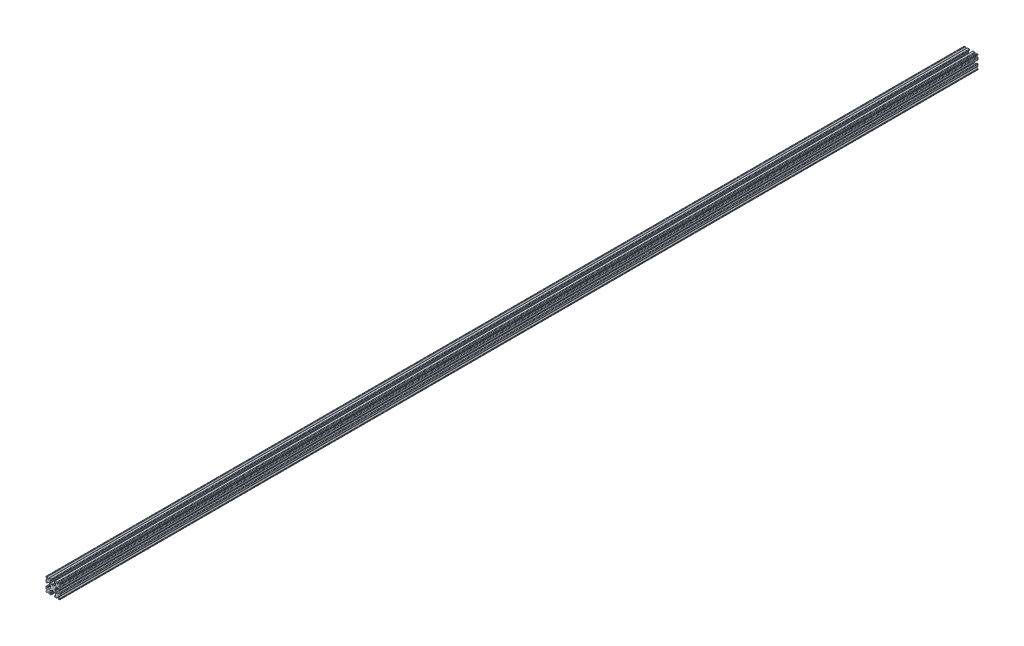
from build123d import *

# Parameters (mm, degrees)
BOSS_EXTRUDE1_DEPTH = 1000


with BuildPart() as part:
    # Sketch1 → Boss-Extrude1 (new body)
    with BuildSketch(Plane.XY):
        with BuildLine():
            Line((0.8255, -2.5470646), (0.8255, -2.774891226))
            ThreePointArc((0.8255, -2.774891226), (0.869377519, -2.89989431), (0.981757709, -2.970049142))
            Line((0.981757709, -2.970049142), (2.509355728, -3.312441801))
            ThreePointArc((2.509355728, -3.312441801), (2.790306203, -3.487828881), (2.9, -3.80033659))
            Line((2.9, -3.80033659), (2.9, -5.9))
            ThreePointArc((2.9, -5.9), (2.841421356, -6.041421356), (2.7, -6.1))
            Line((2.7, -6.1), (2.1, -6.1))
            ThreePointArc((2.1, -6.1), (1.746446609, -6.246446609), (1.6, -6.6))
            Line((1.6, -6.6), (1.6, -7))
            ThreePointArc((1.6, -7), (1.746446609, -7.353553391), (2.1, -7.5))
            Line((2.1, -7.5), (3.9, -7.5))
            ThreePointArc((3.9, -7.5), (4.253553391, -7.353553391), (4.4, -7))
            Line((4.4, -7), (4.4, -6.667766953))
            ThreePointArc((4.4, -6.667766953), (4.708658284, -6.205827187), (5.253553391, -6.314213562))
            Line((5.253553391, -6.314213562), (6.292893219, -7.353553391))
            ThreePointArc((6.292893219, -7.353553391), (6.455104893, -7.461939766), (6.646446609, -7.5))
            Line((6.646446609, -7.5), (7.25, -7.5))
            ThreePointArc((7.25, -7.5), (7.426776695, -7.426776695), (7.5, -7.25))
            Line((7.5, -7.25), (7.5, -6.646446609))
            ThreePointArc((7.5, -6.646446609), (7.461939766, -6.455104893), (7.353553391, -6.292893219))
            Line((7.353553391, -6.292893219), (6.314213562, -5.253553391))
            ThreePointArc((6.314213562, -5.253553391), (6.205827187, -4.708658284), (6.667766953, -4.4))
            Line((6.667766953, -4.4), (7, -4.4))
            ThreePointArc((7, -4.4), (7.353553391, -4.253553391), (7.5, -3.9))
            Line((7.5, -3.9), (7.5, -2.1))
            ThreePointArc((7.5, -2.1), (7.353553391, -1.746446609), (7, -1.6))
            Line((7, -1.6), (6.6, -1.6))
            ThreePointArc((6.6, -1.6), (6.246446609, -1.746446609), (6.1, -2.1))
            Line((6.1, -2.1), (6.1, -2.7))
            ThreePointArc((6.1, -2.7), (6.041421356, -2.841421356), (5.9, -2.9))
            Line((5.9, -2.9), (3.80033659, -2.9))
            ThreePointArc((3.80033659, -2.9), (3.487828881, -2.790306203), (3.312441801, -2.509355728))
            Line((3.312441801, -2.509355728), (2.970049142, -0.981757709))
            ThreePointArc((2.970049142, -0.981757709), (2.89989431, -0.869377519), (2.774891226, -0.8255))
            Line((2.774891226, -0.8255), (2.5470646, -0.8255))
            ThreePointArc((2.5470646, -0.8255), (2.405643244, -0.766921356), (2.3470646, -0.6255))
            Line((2.3470646, -0.6255), (2.3470646, 0.6255))
            ThreePointArc((2.3470646, 0.6255), (2.405643244, 0.766921356), (2.5470646, 0.8255))
            Line((2.5470646, 0.8255), (2.774891226, 0.8255))
            ThreePointArc((2.774891226, 0.8255), (2.89989431, 0.869377519), (2.970049142, 0.981757709))
            Line((2.970049142, 0.981757709), (3.312441801, 2.509355728))
            ThreePointArc((3.312441801, 2.509355728), (3.487828881, 2.790306203), (3.80033659, 2.9))
            Line((3.80033659, 2.9), (5.9, 2.9))
            ThreePointArc((5.9, 2.9), (6.041421356, 2.841421356), (6.1, 2.7))
            Line((6.1, 2.7), (6.1, 2.1))
            ThreePointArc((6.1, 2.1), (6.246446609, 1.746446609), (6.6, 1.6))
            Line((6.6, 1.6), (7, 1.6))
            ThreePointArc((7, 1.6), (7.353553391, 1.746446609), (7.5, 2.1))
            Line((7.5, 2.1), (7.5, 3.9))
            ThreePointArc((7.5, 3.9), (7.353553391, 4.253553391), (7, 4.4))
            Line((7, 4.4), (6.667766953, 4.4))
            ThreePointArc((6.667766953, 4.4), (6.205827187, 4.708658284), (6.314213562, 5.253553391))
            Line((6.314213562, 5.253553391), (7.353553391, 6.292893219))
            ThreePointArc((7.353553391, 6.292893219), (7.461939766, 6.455104893), (7.5, 6.646446609))
            Line((7.5, 6.646446609), (7.5, 7.25))
            ThreePointArc((7.5, 7.25), (7.426776695, 7.426776695), (7.25, 7.5))
            Line((7.25, 7.5), (6.646446609, 7.5))
            ThreePointArc((6.646446609, 7.5), (6.455104893, 7.461939766), (6.292893219, 7.353553391))
            Line((6.292893219, 7.353553391), (5.253553391, 6.314213562))
            ThreePointArc((5.253553391, 6.314213562), (4.708658284, 6.205827187), (4.4, 6.667766953))
            Line((4.4, 6.667766953), (4.4, 7))
            ThreePointArc((4.4, 7), (4.253553391, 7.353553391), (3.9, 7.5))
            Line((3.9, 7.5), (2.1, 7.5))
            ThreePointArc((2.1, 7.5), (1.746446609, 7.353553391), (1.6, 7))
            Line((1.6, 7), (1.6, 6.6))
            ThreePointArc((1.6, 6.6), (1.746446609, 6.246446609), (2.1, 6.1))
            Line((2.1, 6.1), (2.7, 6.1))
            ThreePointArc((2.7, 6.1), (2.841421356, 6.041421356), (2.9, 5.9))
            Line((2.9, 5.9), (2.9, 3.80033659))
            ThreePointArc((2.9, 3.80033659), (2.790306203, 3.487828881), (2.509355728, 3.312441801))
            Line((2.509355728, 3.312441801), (0.981757709, 2.970049142))
            ThreePointArc((0.981757709, 2.970049142), (0.869377519, 2.89989431), (0.8255, 2.774891226))
            Line((0.8255, 2.774891226), (0.8255, 2.5470646))
            ThreePointArc((0.8255, 2.5470646), (0.766921356, 2.405643244), (0.6255, 2.3470646))
            Line((0.6255, 2.3470646), (-0.6255, 2.3470646))
            ThreePointArc((-0.6255, 2.3470646), (-0.766921356, 2.405643244), (-0.8255, 2.5470646))
            Line((-0.8255, 2.5470646), (-0.8255, 2.774891226))
            ThreePointArc((-0.8255, 2.774891226), (-0.869377519, 2.89989431), (-0.981757709, 2.970049142))
            Line((-0.981757709, 2.970049142), (-2.509355728, 3.312441801))
            ThreePointArc((-2.509355728, 3.312441801), (-2.790306203, 3.487828881), (-2.9, 3.80033659))
            Line((-2.9, 3.80033659), (-2.9, 5.9))
            ThreePointArc((-2.9, 5.9), (-2.841421356, 6.041421356), (-2.7, 6.1))
            Line((-2.7, 6.1), (-2.1, 6.1))
            ThreePointArc((-2.1, 6.1), (-1.746446609, 6.246446609), (-1.6, 6.6))
            Line((-1.6, 6.6), (-1.6, 7))
            ThreePointArc((-1.6, 7), (-1.746446609, 7.353553391), (-2.1, 7.5))
            Line((-2.1, 7.5), (-3.9, 7.5))
            ThreePointArc((-3.9, 7.5), (-4.253553391, 7.353553391), (-4.4, 7))
            Line((-4.4, 7), (-4.4, 6.667766953))
            ThreePointArc((-4.4, 6.667766953), (-4.708658284, 6.205827187), (-5.253553391, 6.314213562))
            Line((-5.253553391, 6.314213562), (-6.292893219, 7.353553391))
            ThreePointArc((-6.292893219, 7.353553391), (-6.455104893, 7.461939766), (-6.646446609, 7.5))
            Line((-6.646446609, 7.5), (-7.25, 7.5))
            ThreePointArc((-7.25, 7.5), (-7.426776695, 7.426776695), (-7.5, 7.25))
            Line((-7.5, 7.25), (-7.5, 6.646446609))
            ThreePointArc((-7.5, 6.646446609), (-7.461939766, 6.455104893), (-7.353553391, 6.292893219))
            Line((-7.353553391, 6.292893219), (-6.314213562, 5.253553391))
            ThreePointArc((-6.314213562, 5.253553391), (-6.205827187, 4.708658284), (-6.667766953, 4.4))
            Line((-6.667766953, 4.4), (-7, 4.4))
            ThreePointArc((-7, 4.4), (-7.353553391, 4.253553391), (-7.5, 3.9))
            Line((-7.5, 3.9), (-7.5, 2.1))
            ThreePointArc((-7.5, 2.1), (-7.353553391, 1.746446609), (-7, 1.6))
            Line((-7, 1.6), (-6.6, 1.6))
            ThreePointArc((-6.6, 1.6), (-6.246446609, 1.746446609), (-6.1, 2.1))
            Line((-6.1, 2.1), (-6.1, 2.7))
            ThreePointArc((-6.1, 2.7), (-6.041421356, 2.841421356), (-5.9, 2.9))
            Line((-5.9, 2.9), (-3.80033659, 2.9))
            ThreePointArc((-3.80033659, 2.9), (-3.487828881, 2.790306203), (-3.312441801, 2.509355728))
            Line((-3.312441801, 2.509355728), (-2.970049142, 0.981757709))
            ThreePointArc((-2.970049142, 0.981757709), (-2.89989431, 0.869377519), (-2.774891226, 0.8255))
            Line((-2.774891226, 0.8255), (-2.5470646, 0.8255))
            ThreePointArc((-2.5470646, 0.8255), (-2.405643244, 0.766921356), (-2.3470646, 0.6255))
            Line((-2.3470646, 0.6255), (-2.3470646, -0.6255))
            ThreePointArc((-2.3470646, -0.6255), (-2.405643244, -0.766921356), (-2.5470646, -0.8255))
            Line((-2.5470646, -0.8255), (-2.774891226, -0.8255))
            ThreePointArc((-2.774891226, -0.8255), (-2.89989431, -0.869377519), (-2.970049142, -0.981757709))
            Line((-2.970049142, -0.981757709), (-3.312441801, -2.509355728))
            ThreePointArc((-3.312441801, -2.509355728), (-3.487828881, -2.790306203), (-3.80033659, -2.9))
            Line((-3.80033659, -2.9), (-5.9, -2.9))
            ThreePointArc((-5.9, -2.9), (-6.041421356, -2.841421356), (-6.1, -2.7))
            Line((-6.1, -2.7), (-6.1, -2.1))
            ThreePointArc((-6.1, -2.1), (-6.246446609, -1.746446609), (-6.6, -1.6))
            Line((-6.6, -1.6), (-7, -1.6))
            ThreePointArc((-7, -1.6), (-7.353553391, -1.746446609), (-7.5, -2.1))
            Line((-7.5, -2.1), (-7.5, -3.9))
            ThreePointArc((-7.5, -3.9), (-7.353553391, -4.253553391), (-7, -4.4))
            Line((-7, -4.4), (-6.667766953, -4.4))
            ThreePointArc((-6.667766953, -4.4), (-6.205827187, -4.708658284), (-6.314213562, -5.253553391))
            Line((-6.314213562, -5.253553391), (-7.353553391, -6.292893219))
            ThreePointArc((-7.353553391, -6.292893219), (-7.461939766, -6.455104893), (-7.5, -6.646446609))
            Line((-7.5, -6.646446609), (-7.5, -7.25))
            ThreePointArc((-7.5, -7.25), (-7.426776695, -7.426776695), (-7.25, -7.5))
            Line((-7.25, -7.5), (-6.646446609, -7.5))
            ThreePointArc((-6.646446609, -7.5), (-6.455104893, -7.461939766), (-6.292893219, -7.353553391))
            Line((-6.292893219, -7.353553391), (-5.253553391, -6.314213562))
            ThreePointArc((-5.253553391, -6.314213562), (-4.708658284, -6.205827187), (-4.4, -6.667766953))
            Line((-4.4, -6.667766953), (-4.4, -7))
            ThreePointArc((-4.4, -7), (-4.253553391, -7.353553391), (-3.9, -7.5))
            Line((-3.9, -7.5), (-2.1, -7.5))
            ThreePointArc((-2.1, -7.5), (-1.746446609, -7.353553391), (-1.6, -7))
            Line((-1.6, -7), (-1.6, -6.6))
            ThreePointArc((-1.6, -6.6), (-1.746446609, -6.246446609), (-2.1, -6.1))
            Line((-2.1, -6.1), (-2.7, -6.1))
            ThreePointArc((-2.7, -6.1), (-2.841421356, -6.041421356), (-2.9, -5.9))
            Line((-2.9, -5.9), (-2.9, -3.80033659))
            ThreePointArc((-2.9, -3.80033659), (-2.790306203, -3.487828881), (-2.509355728, -3.312441801))
            Line((-2.509355728, -3.312441801), (-0.981757709, -2.970049142))
            ThreePointArc((-0.981757709, -2.970049142), (-0.869377519, -2.89989431), (-0.8255, -2.774891226))
            Line((-0.8255, -2.774891226), (-0.8255, -2.5470646))
            ThreePointArc((-0.8255, -2.5470646), (-0.766921356, -2.405643244), (-0.6255, -2.3470646))
            Line((-0.6255, -2.3470646), (0.6255, -2.3470646))
            ThreePointArc((0.6255, -2.3470646), (0.766921356, -2.405643244), (0.8255, -2.5470646))
        make_face()
    extrude(amount=BOSS_EXTRUDE1_DEPTH)


solid = part.part
